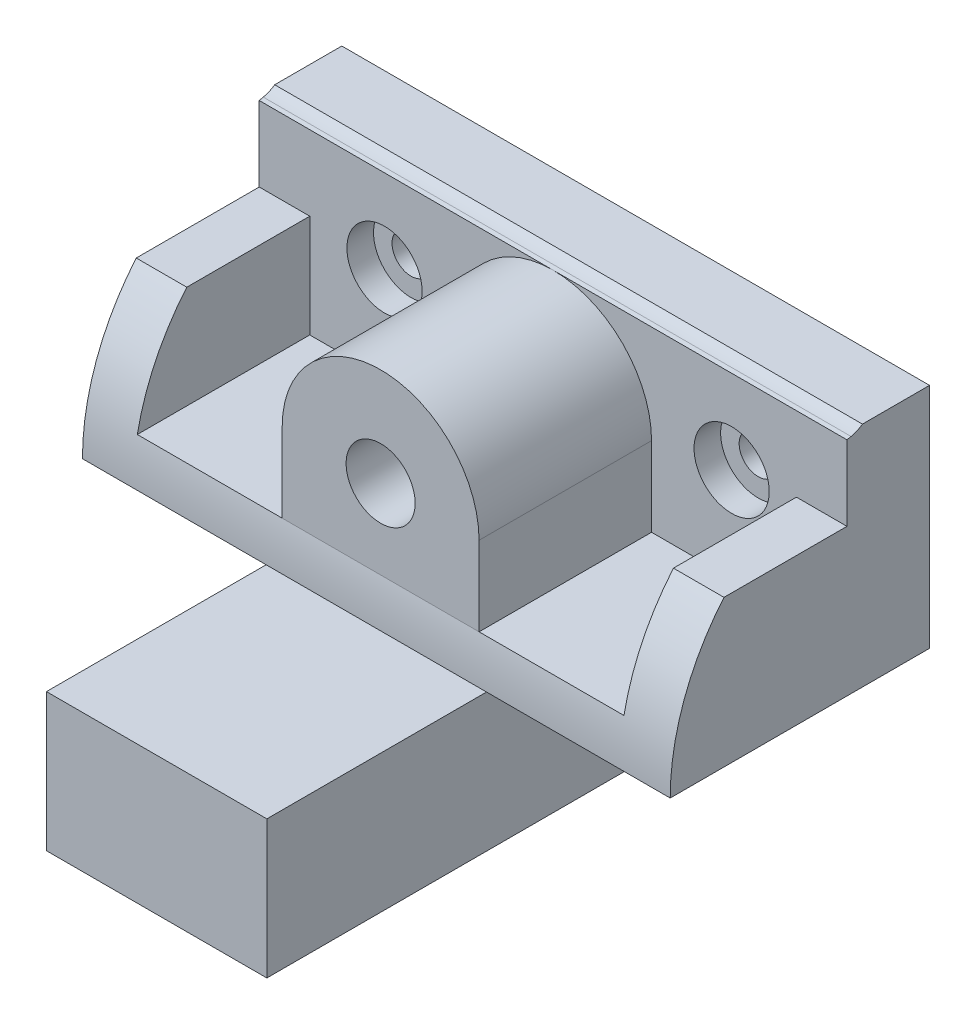
from build123d import *

# Parameters (mm, degrees)
JAW_SIDE_EXTRUDE_DEPTH                           = 101.6
SKETCH2_W                                        = 84.1248
SKETCH2_H                                        = 30.5562
HOLLOW_CUT_EXTRUDE_DEPTH                         = 37.592
SKETCH3_R                                        = 5.969
SCREW_BOSS_EXTRUDE_DEPTH                         = 29.811288
SKETCH5_W                                        = 38.1
SKETCH5_H                                        = 23.8252
FOOT_EXTRUDE_DEPTH                               = 82.804
CBORE_FOR_M6_PAN_HEAD_MACHINE_SCREW1_D           = 6.6
CBORE_FOR_M6_PAN_HEAD_MACHINE_SCREW1_CBORE_D     = 13
CBORE_FOR_M6_PAN_HEAD_MACHINE_SCREW1_CBORE_DEPTH = 4.6
SKETCH12_W                                       = 14.651439237
SKETCH12_H                                       = 5.842
TOP_TRIM_CUT_EXTRUDE3_DEPTH                      = 120.902057968
SKETCH13_W                                       = 23.442855491
SKETCH13_H                                       = 12.95199816
WEB_TRIM_1_CUT_EXTRUDE4_DEPTH                    = 8.7376
SKETCH14_W                                       = 37.878491239
SKETCH14_H                                       = 12.95199816
WEB_TRIM_2_CUT_EXTRUDE5_DEPTH                    = 8.7376


with BuildPart() as part:
    # Sketch1 → Jaw side extrude (new body)
    with BuildSketch(Plane(origin=(0, 0, 0), x_dir=(0, 0, -1), z_dir=(1, 0, 0))):
        with BuildLine():
            Line((35.433, 45.212), (35.433, 43.647675453))
            ThreePointArc((35.433, 43.647675453), (34.258233808, 40.336625769), (31.259334135, 38.5064))
            ThreePointArc((31.259334135, 38.5064), (8.79859819, 24.798633085), (0, 0))
            Line((0, 0), (44.831, 0))
            Line((44.831, 0), (44.831, 45.212))
            Line((44.831, 45.212), (35.433, 45.212))
        make_face()
    extrude(amount=JAW_SIDE_EXTRUDE_DEPTH)

    # Sketch2 → Hollow cut extrude (cut)
    with BuildSketch(Plane(origin=(0, 45.212, 0), x_dir=(1, 0, 0), z_dir=(0, 1, 0))):
        with Locations((50.8, 15.2781)):
            Rectangle(SKETCH2_W, SKETCH2_H)
    extrude(amount=-HOLLOW_CUT_EXTRUDE_DEPTH, mode=Mode.SUBTRACT)

    # Sketch3 → Screw boss extrude (add)
    with BuildSketch(Plane.XY.offset(-30.5562)):
        with BuildLine():
            Line((67.818, 7.62), (67.818, 21.33399816))
            ThreePointArc((67.818, 21.33399816), (50.8, 38.35199816), (33.782, 21.33399816))
            Line((33.782, 21.33399816), (33.782, 7.62))
            Line((33.782, 7.62), (67.818, 7.62))
        make_face()
        with Locations((50.8, 21.33399816)):
            Circle(SKETCH3_R, mode=Mode.SUBTRACT)
    extrude(amount=SCREW_BOSS_EXTRUDE_DEPTH)

    # Sketch5 → Foot extrude (add)
    with BuildSketch(Plane(origin=(0, 0, -44.831), x_dir=(-1, 0, 0), z_dir=(0, 0, -1))):
        with Locations((-50.8, -11.9126)):
            Rectangle(SKETCH5_W, SKETCH5_H)
    extrude(amount=-FOOT_EXTRUDE_DEPTH)

    # CBORE for M6 Pan Head Machine Screw1 (through all)
    with Locations(Plane(origin=(50.8, -38.1, -30.5562), x_dir=(1, 0, 0), z_dir=(0, 0, 1))):
        with Locations((-29.14300736, 61.964884424), (30.859893074, 61.964884424)):
            CounterBoreHole(CBORE_FOR_M6_PAN_HEAD_MACHINE_SCREW1_D / 2, CBORE_FOR_M6_PAN_HEAD_MACHINE_SCREW1_CBORE_D / 2, CBORE_FOR_M6_PAN_HEAD_MACHINE_SCREW1_CBORE_DEPTH)

    # Sketch12 → top trim Cut-Extrude3 (cut, through all)
    with BuildSketch(Plane.ZY):
        with Locations((-37.505280382, 42.291)):
            Rectangle(SKETCH12_W, SKETCH12_H)
    extrude(amount=-TOP_TRIM_CUT_EXTRUDE3_DEPTH, mode=Mode.SUBTRACT)

    # Sketch13 → web trim 1 Cut-Extrude4 (cut)
    with BuildSketch(Plane.ZY.offset(-8.7376)):
        with Locations((-18.834772254, 31.87599908)):
            Rectangle(SKETCH13_W, SKETCH13_H)
    extrude(amount=WEB_TRIM_1_CUT_EXTRUDE4_DEPTH, mode=Mode.SUBTRACT)

    # Sketch14 → web trim 2 Cut-Extrude5 (cut)
    with BuildSketch(Plane(origin=(92.8624, 0, 0), x_dir=(0, 0, -1), z_dir=(1, 0, 0))):
        with Locations((11.616954381, 31.87599908)):
            Rectangle(SKETCH14_W, SKETCH14_H)
    extrude(amount=WEB_TRIM_2_CUT_EXTRUDE5_DEPTH, mode=Mode.SUBTRACT)


solid = part.part
